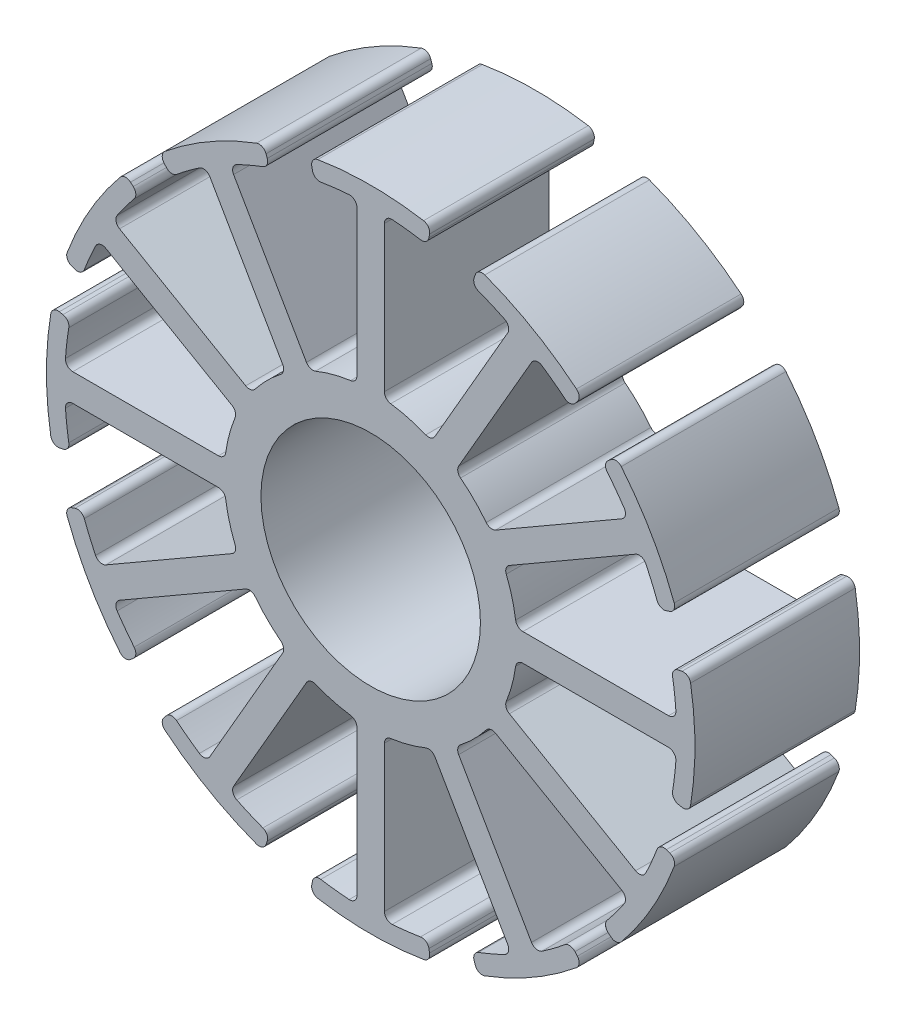
from build123d import *

# Parameters (mm, degrees)
SKETCH1_R           = 6
BOSS_EXTRUDE1_DEPTH = 9
FILLET1_R           = 0.4


with BuildPart() as part:
    # Sketch1 → Boss-Extrude1 (new body)
    with BuildSketch(Plane.XY):
        with BuildLine():
            ThreePointArc((-16.708175394, 0.75), (-16.612746125, 1.934500243), (-16.433450213, 3.109234488))
            Line((-16.433450213, 3.109234488), (-17.416018238, 3.295137895))
            ThreePointArc((-17.416018238, 3.295137895), (-17.725, 0), (-17.416018238, -3.295137895))
            Line((-17.416018238, -3.295137895), (-16.433450213, -3.109234488))
            ThreePointArc((-16.433450213, -3.109234488), (-16.612746125, -1.934500243), (-16.708175394, -0.75))
            Line((-16.708175394, -0.75), (-7.964766161, -0.75))
            ThreePointArc((-7.964766161, -0.75), (-7.72740661, -2.070552361), (-7.272689831, -3.332864028))
            Line((-7.272689831, -3.332864028), (-14.844704342, -7.704568644))
            ThreePointArc((-14.844704342, -7.704568644), (-15.354310292, -6.631046709), (-15.7864026, -5.524049054))
            Line((-15.7864026, -5.524049054), (-16.730283174, -5.854335993))
            ThreePointArc((-16.730283174, -5.854335993), (-15.350300282, -8.8625), (-13.435145279, -11.561682245))
            Line((-13.435145279, -11.561682245), (-12.677168112, -10.909401159))
            ThreePointArc((-12.677168112, -10.909401159), (-13.419810049, -9.981699416), (-14.094704342, -9.00360675))
            Line((-14.094704342, -9.00360675), (-6.522689831, -4.631902133))
            ThreePointArc((-6.522689831, -4.631902133), (-5.656854249, -5.656854249), (-4.631902133, -6.522689831))
            Line((-4.631902133, -6.522689831), (-9.00360675, -14.094704342))
            ThreePointArc((-9.00360675, -14.094704342), (-9.981699416, -13.419810049), (-10.909401159, -12.677168112))
            Line((-10.909401159, -12.677168112), (-11.561682245, -13.435145279))
            ThreePointArc((-11.561682245, -13.435145279), (-8.8625, -15.350300282), (-5.854335993, -16.730283174))
            Line((-5.854335993, -16.730283174), (-5.524049054, -15.7864026))
            ThreePointArc((-5.524049054, -15.7864026), (-6.631046709, -15.354310292), (-7.704568644, -14.844704342))
            Line((-7.704568644, -14.844704342), (-3.332864028, -7.272689831))
            ThreePointArc((-3.332864028, -7.272689831), (-2.070552361, -7.72740661), (-0.75, -7.964766161))
            Line((-0.75, -7.964766161), (-0.75, -16.708175394))
            ThreePointArc((-0.75, -16.708175394), (-1.934500243, -16.612746125), (-3.109234488, -16.433450213))
            Line((-3.109234488, -16.433450213), (-3.295137895, -17.416018238))
            ThreePointArc((-3.295137895, -17.416018238), (0, -17.725), (3.295137895, -17.416018238))
            Line((3.295137895, -17.416018238), (3.109234488, -16.433450213))
            ThreePointArc((3.109234488, -16.433450213), (1.934500243, -16.612746125), (0.75, -16.708175394))
            Line((0.75, -16.708175394), (0.75, -7.964766161))
            ThreePointArc((0.75, -7.964766161), (2.070552361, -7.72740661), (3.332864028, -7.272689831))
            Line((3.332864028, -7.272689831), (7.704568644, -14.844704342))
            ThreePointArc((7.704568644, -14.844704342), (6.631046709, -15.354310292), (5.524049054, -15.7864026))
            Line((5.524049054, -15.7864026), (5.854335993, -16.730283174))
            ThreePointArc((5.854335993, -16.730283174), (8.8625, -15.350300282), (11.561682245, -13.435145279))
            Line((11.561682245, -13.435145279), (10.909401159, -12.677168112))
            ThreePointArc((10.909401159, -12.677168112), (9.981699416, -13.419810049), (9.00360675, -14.094704342))
            Line((9.00360675, -14.094704342), (4.631902133, -6.522689831))
            ThreePointArc((4.631902133, -6.522689831), (5.656854249, -5.656854249), (6.522689831, -4.631902133))
            Line((6.522689831, -4.631902133), (14.094704342, -9.00360675))
            ThreePointArc((14.094704342, -9.00360675), (13.419810049, -9.981699416), (12.677168112, -10.909401159))
            Line((12.677168112, -10.909401159), (13.435145279, -11.561682245))
            ThreePointArc((13.435145279, -11.561682245), (15.350300282, -8.8625), (16.730283174, -5.854335993))
            Line((16.730283174, -5.854335993), (15.7864026, -5.524049054))
            ThreePointArc((15.7864026, -5.524049054), (15.354310292, -6.631046709), (14.844704342, -7.704568644))
            Line((14.844704342, -7.704568644), (7.272689831, -3.332864028))
            ThreePointArc((7.272689831, -3.332864028), (7.72740661, -2.070552361), (7.964766161, -0.75))
            Line((7.964766161, -0.75), (16.708175394, -0.75))
            ThreePointArc((16.708175394, -0.75), (16.612746125, -1.934500243), (16.433450213, -3.109234488))
            Line((16.433450213, -3.109234488), (17.416018238, -3.295137895))
            ThreePointArc((17.416018238, -3.295137895), (17.725, 0), (17.416018238, 3.295137895))
            Line((17.416018238, 3.295137895), (16.433450213, 3.109234488))
            ThreePointArc((16.433450213, 3.109234488), (16.612746125, 1.934500243), (16.708175394, 0.75))
            Line((16.708175394, 0.75), (7.964766161, 0.75))
            ThreePointArc((7.964766161, 0.75), (7.72740661, 2.070552361), (7.272689831, 3.332864028))
            Line((7.272689831, 3.332864028), (14.844704342, 7.704568644))
            ThreePointArc((14.844704342, 7.704568644), (15.354310292, 6.631046709), (15.7864026, 5.524049054))
            Line((15.7864026, 5.524049054), (16.730283174, 5.854335993))
            ThreePointArc((16.730283174, 5.854335993), (15.350300282, 8.8625), (13.435145279, 11.561682245))
            Line((13.435145279, 11.561682245), (12.677168112, 10.909401159))
            ThreePointArc((12.677168112, 10.909401159), (13.419810049, 9.981699416), (14.094704342, 9.00360675))
            Line((14.094704342, 9.00360675), (6.522689831, 4.631902133))
            ThreePointArc((6.522689831, 4.631902133), (5.656854249, 5.656854249), (4.631902133, 6.522689831))
            Line((4.631902133, 6.522689831), (9.00360675, 14.094704342))
            ThreePointArc((9.00360675, 14.094704342), (9.981699416, 13.419810049), (10.909401159, 12.677168112))
            Line((10.909401159, 12.677168112), (11.561682245, 13.435145279))
            ThreePointArc((11.561682245, 13.435145279), (8.8625, 15.350300282), (5.854335993, 16.730283174))
            Line((5.854335993, 16.730283174), (5.524049054, 15.7864026))
            ThreePointArc((5.524049054, 15.7864026), (6.631046709, 15.354310292), (7.704568644, 14.844704342))
            Line((7.704568644, 14.844704342), (3.332864028, 7.272689831))
            ThreePointArc((3.332864028, 7.272689831), (2.070552361, 7.72740661), (0.75, 7.964766161))
            Line((0.75, 7.964766161), (0.75, 16.708175394))
            ThreePointArc((0.75, 16.708175394), (1.934500243, 16.612746125), (3.109234488, 16.433450213))
            Line((3.109234488, 16.433450213), (3.295137895, 17.416018238))
            ThreePointArc((3.295137895, 17.416018238), (0, 17.725), (-3.295137895, 17.416018238))
            Line((-3.295137895, 17.416018238), (-3.109234488, 16.433450213))
            ThreePointArc((-3.109234488, 16.433450213), (-1.934500243, 16.612746125), (-0.75, 16.708175394))
            Line((-0.75, 16.708175394), (-0.75, 7.964766161))
            ThreePointArc((-0.75, 7.964766161), (-2.070552361, 7.72740661), (-3.332864028, 7.272689831))
            Line((-3.332864028, 7.272689831), (-7.704568644, 14.844704342))
            ThreePointArc((-7.704568644, 14.844704342), (-6.631046709, 15.354310292), (-5.524049054, 15.7864026))
            Line((-5.524049054, 15.7864026), (-5.854335993, 16.730283174))
            ThreePointArc((-5.854335993, 16.730283174), (-8.8625, 15.350300282), (-11.561682245, 13.435145279))
            Line((-11.561682245, 13.435145279), (-10.909401159, 12.677168112))
            ThreePointArc((-10.909401159, 12.677168112), (-9.981699416, 13.419810049), (-9.00360675, 14.094704342))
            Line((-9.00360675, 14.094704342), (-4.631902133, 6.522689831))
            ThreePointArc((-4.631902133, 6.522689831), (-5.656854249, 5.656854249), (-6.522689831, 4.631902133))
            Line((-6.522689831, 4.631902133), (-14.094704342, 9.00360675))
            ThreePointArc((-14.094704342, 9.00360675), (-13.419810049, 9.981699416), (-12.677168112, 10.909401159))
            Line((-12.677168112, 10.909401159), (-13.435145279, 11.561682245))
            ThreePointArc((-13.435145279, 11.561682245), (-15.350300282, 8.8625), (-16.730283174, 5.854335993))
            Line((-16.730283174, 5.854335993), (-15.7864026, 5.524049054))
            ThreePointArc((-15.7864026, 5.524049054), (-15.354310292, 6.631046709), (-14.844704342, 7.704568644))
            Line((-14.844704342, 7.704568644), (-7.272689831, 3.332864028))
            ThreePointArc((-7.272689831, 3.332864028), (-7.72740661, 2.070552361), (-7.964766161, 0.75))
            Line((-7.964766161, 0.75), (-16.708175394, 0.75))
        make_face()
        with Locations(Location((0, 0, 0), (0, 0, 180))):
            Circle(SKETCH1_R, mode=Mode.SUBTRACT)
    extrude(amount=BOSS_EXTRUDE1_DEPTH)

    # Fillet1
    fillet1_edges = [part.edges().sort_by_distance(p)[0] for p in [
        (3.332864028, -7.272689831, 4.5),
        (7.704568644, -14.844704342, 4.5),
        (5.524049054, -15.7864026, 4.5),
        (5.854335993, -16.730283174, 4.5),
        (11.561682245, -13.435145279, 4.5),
        (10.909401159, -12.677168112, 4.5),
        (9.00360675, -14.094704342, 4.5),
        (4.631902133, -6.522689831, 4.5),
        (6.522689831, -4.631902133, 4.5),
        (14.094704342, -9.00360675, 4.5),
        (12.677168112, -10.909401159, 4.5),
        (13.435145279, -11.561682245, 4.5),
        (16.730283174, -5.854335993, 4.5),
        (15.7864026, -5.524049054, 4.5),
        (14.844704342, -7.704568644, 4.5),
        (-7.964766161, -0.75, 4.5),
        (7.272689831, -3.332864028, 4.5),
        (7.964766161, -0.75, 4.5),
        (16.708175394, -0.75, 4.5),
        (16.433450213, -3.109234488, 4.5),
        (17.416018238, -3.295137895, 4.5),
        (17.416018238, 3.295137895, 4.5),
        (16.433450213, 3.109234488, 4.5),
        (16.708175394, 0.75, 4.5),
        (7.964766161, 0.75, 4.5),
        (7.272689831, 3.332864028, 4.5),
        (14.844704342, 7.704568644, 4.5),
        (15.7864026, 5.524049054, 4.5),
        (16.730283174, 5.854335993, 4.5),
        (-7.272689831, -3.332864028, 4.5),
        (13.435145279, 11.561682245, 4.5),
        (12.677168112, 10.909401159, 4.5),
        (14.094704342, 9.00360675, 4.5),
        (-14.844704342, -7.704568644, 4.5),
        (6.522689831, 4.631902133, 4.5),
        (4.631902133, 6.522689831, 4.5),
        (9.00360675, 14.094704342, 4.5),
        (10.909401159, 12.677168112, 4.5),
        (11.561682245, 13.435145279, 4.5),
        (-15.7864026, -5.524049054, 4.5),
        (5.854335993, 16.730283174, 4.5),
        (5.524049054, 15.7864026, 4.5),
        (7.704568644, 14.844704342, 4.5),
        (3.332864028, 7.272689831, 4.5),
        (0.75, 7.964766161, 4.5),
        (0.75, 16.708175394, 4.5),
        (3.109234488, 16.433450213, 4.5),
        (3.295137895, 17.416018238, 4.5),
        (-3.295137895, 17.416018238, 4.5),
        (-3.109234488, 16.433450213, 4.5),
        (-0.75, 16.708175394, 4.5),
        (-0.75, 7.964766161, 4.5),
        (-3.332864028, 7.272689831, 4.5),
        (-7.704568644, 14.844704342, 4.5),
        (-5.524049054, 15.7864026, 4.5),
        (-5.854335993, 16.730283174, 4.5),
        (-11.561682245, 13.435145279, 4.5),
        (-10.909401159, 12.677168112, 4.5),
        (-9.00360675, 14.094704342, 4.5),
        (-16.730283174, -5.854335993, 4.5),
        (-4.631902133, 6.522689831, 4.5),
        (-6.522689831, 4.631902133, 4.5),
        (-14.094704342, 9.00360675, 4.5),
        (-12.677168112, 10.909401159, 4.5),
        (-13.435145279, 11.561682245, 4.5),
        (-16.730283174, 5.854335993, 4.5),
        (-15.7864026, 5.524049054, 4.5),
        (-14.844704342, 7.704568644, 4.5),
        (-7.272689831, 3.332864028, 4.5),
        (-7.964766161, 0.75, 4.5),
        (-16.708175394, 0.75, 4.5),
        (-16.433450213, 3.109234488, 4.5),
        (-17.416018238, 3.295137895, 4.5),
        (-13.435145279, -11.561682245, 4.5),
        (-17.416018238, -3.295137895, 4.5),
        (-12.677168112, -10.909401159, 4.5),
        (-14.094704342, -9.00360675, 4.5),
        (-6.522689831, -4.631902133, 4.5),
        (-4.631902133, -6.522689831, 4.5),
        (-9.00360675, -14.094704342, 4.5),
        (-10.909401159, -12.677168112, 4.5),
        (-11.561682245, -13.435145279, 4.5),
        (-5.854335993, -16.730283174, 4.5),
        (-5.524049054, -15.7864026, 4.5),
        (-7.704568644, -14.844704342, 4.5),
        (-16.433450213, -3.109234488, 4.5),
        (-3.332864028, -7.272689831, 4.5),
        (-0.75, -7.964766161, 4.5),
        (-0.75, -16.708175394, 4.5),
        (-3.109234488, -16.433450213, 4.5),
        (-3.295137895, -17.416018238, 4.5),
        (-16.708175394, -0.75, 4.5),
        (3.295137895, -17.416018238, 4.5),
        (3.109234488, -16.433450213, 4.5),
        (0.75, -16.708175394, 4.5),
        (0.75, -7.964766161, 4.5),
    ]]
    fillet(fillet1_edges, radius=FILLET1_R)


solid = part.part
